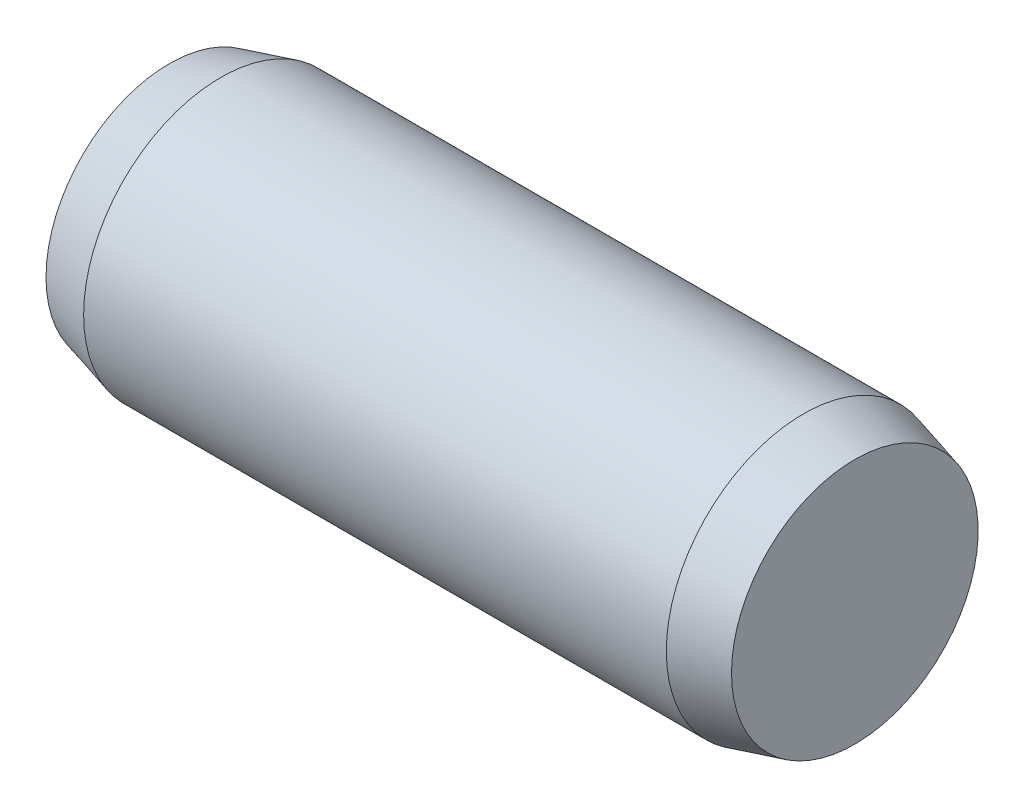
from build123d import *


with BuildPart() as part:
    # Sketch1 → Base-Revolve (revolve)
    with BuildSketch(Plane.XY, mode=Mode.PRIVATE) as base_revolve_sk:
        Polygon((0, 0), (40, 0), (40, 7.196152423), (37, 8), (3, 8), (0, 7.196152423), align=None)
    revolve(base_revolve_sk.sketch.rotate(Axis((-6.35, 0, 0), (1, 0, 0)), 90), axis=Axis((-6.35, 0, 0), (1, 0, 0)))


solid = part.part
